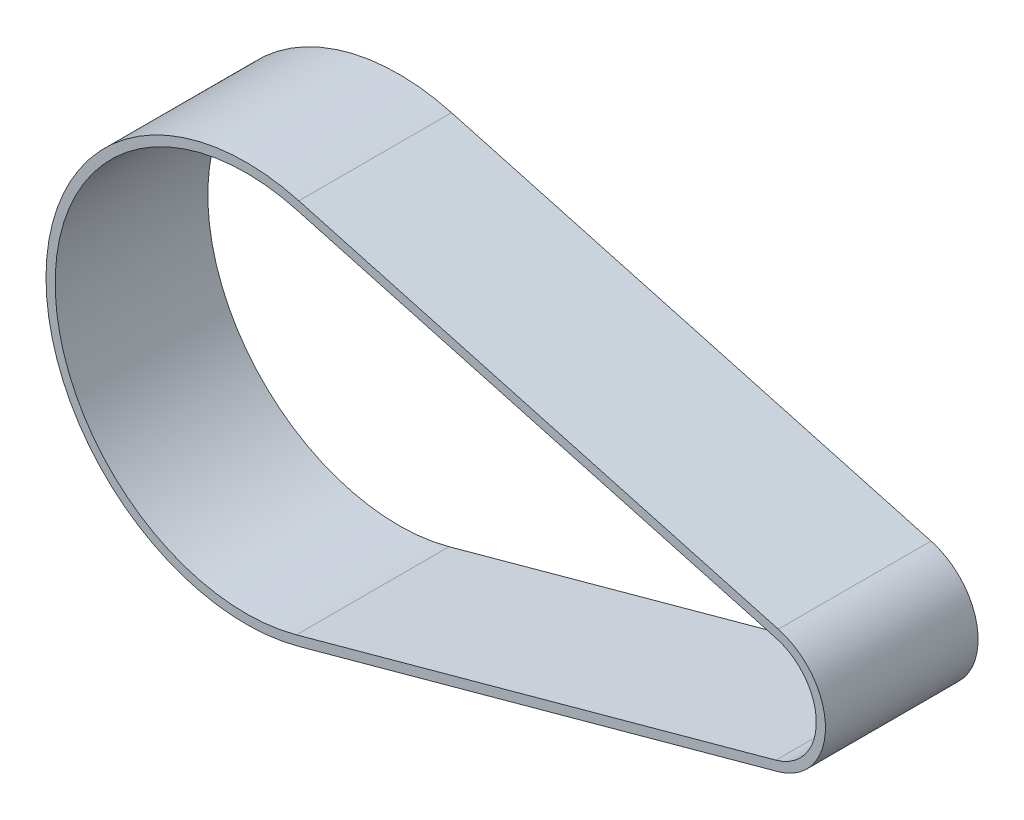
from build123d import *

# Parameters (mm, degrees)
BOSS_EXTRUDE1_DEPTH = 25


with BuildPart() as part:
    # Sketch1 → Boss-Extrude1 (new body)
    with BuildSketch(Plane.XY):
        with BuildLine():
            Line((-75.751981043, 31.597932972), (2.766521327, 10.108252062))
            ThreePointArc((2.766521327, 10.108252062), (10.48, 0), (2.766521327, -10.108252062))
            Line((2.766521327, -10.108252062), (-75.751981043, -31.597932972))
            ThreePointArc((-75.751981043, -31.597932972), (-117.16, 0), (-75.751981043, 31.597932972))
        make_face()
        with BuildLine():
            Line((-76.147952607, 30.151141169), (2.370549763, 8.661460259))
            ThreePointArc((2.370549763, 8.661460259), (8.98, 0), (2.370549763, -8.661460259))
            Line((2.370549763, -8.661460259), (-76.147952607, -30.151141169))
            ThreePointArc((-76.147952607, -30.151141169), (-115.66, 0), (-76.147952607, 30.151141169))
        make_face(mode=Mode.SUBTRACT)
    extrude(amount=BOSS_EXTRUDE1_DEPTH)


solid = part.part
